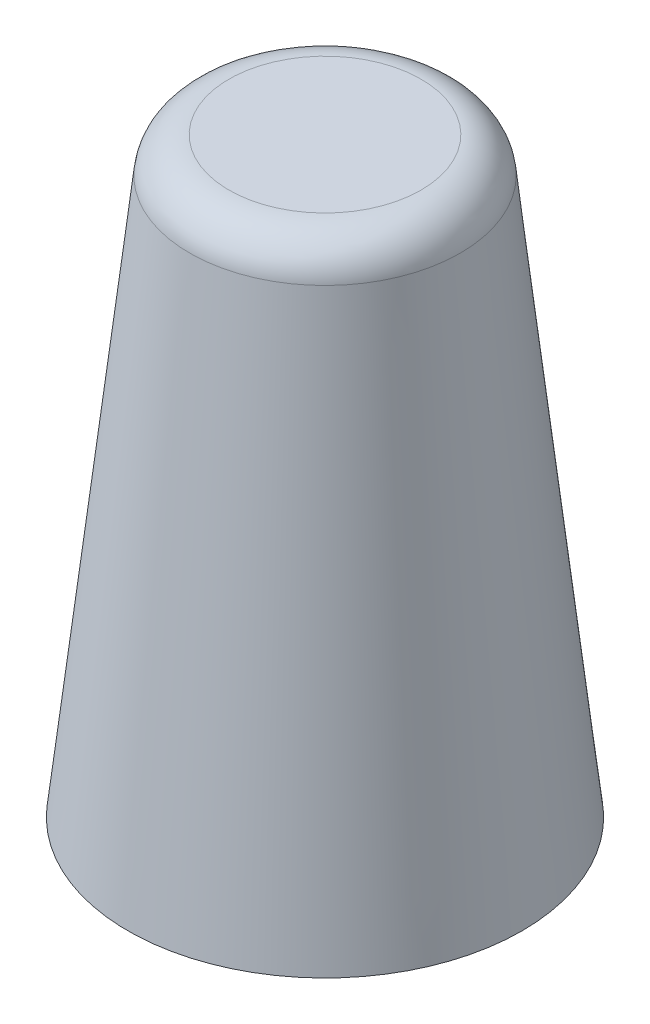
from build123d import *


with BuildPart() as part:
    # Эскиз1 → Повернуть2 (revolve)
    with BuildSketch(Plane.XY):
        with BuildLine():
            Line((0, 0), (15, 0))
            Line((15, 0), (10.296522825, 42.331294578))
            ThreePointArc((10.296522825, 42.331294578), (9.315636008, 44.235384054), (7.314871621, 45))
            Line((7.314871621, 45), (0, 45))
            Line((0, 45), (0, 0))
        make_face()
    revolve(axis=Axis((0, -451.658035065, 0), (0, 1, 0)))


solid = part.part
